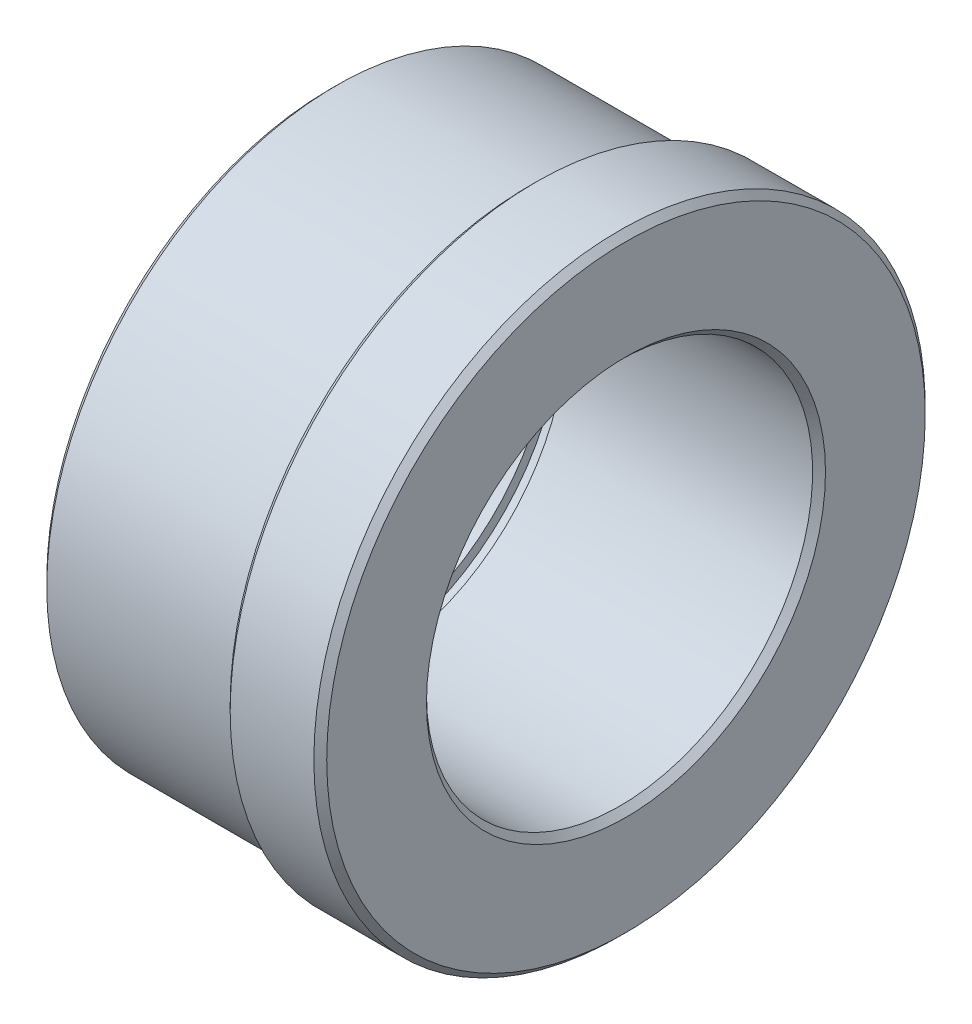
from build123d import *

# Parameters (mm, degrees)
CHAMFER_1_SIZE = 1


with BuildPart() as part:
    # 草图1 → 旋转1 (revolve)
    with BuildSketch(Plane.XY, mode=Mode.PRIVATE) as revolve_1_sk:
        Polygon((0, 30), (0, 45), (31, 45), (31, 47.5), (46, 47.5), (46, 30), (6.7, 30), (6.7, 31.5), (4.5, 31.5), (4.5, 30), align=None)
    revolve(revolve_1_sk.sketch.rotate(Axis((0, 0, 0), (1, 0, 0)), 90), axis=Axis((0, 0, 0), (1, 0, 0)))

    # 倒角1
    chamfer_1_edges = [part.edges().sort_by_distance(p)[0] for p in [
        (0, 0, -30),
        (0, 0, -45),
        (31, 0, -47.5),
        (46, 0, -47.5),
        (46, 0, -30),
    ]]
    chamfer(chamfer_1_edges, length=CHAMFER_1_SIZE)


solid = part.part
